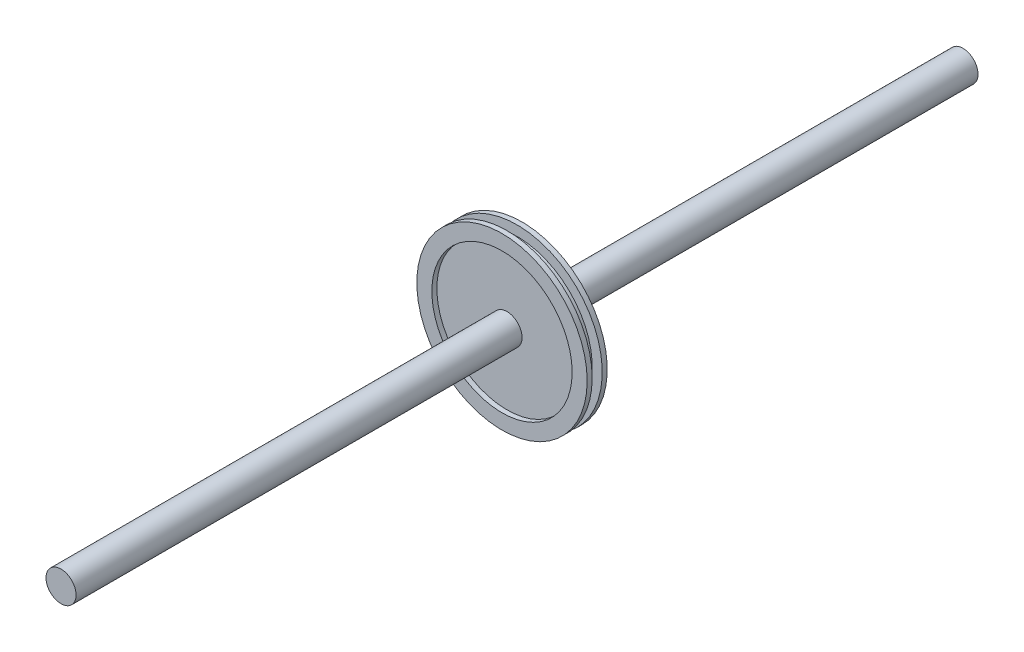
from build123d import *

# Parameters (mm, degrees)
SKETCH1_R           = 7.5
BOSS_EXTRUDE1_DEPTH = 0.5
SKETCH3_R           = 8.5
SKETCH3_R_2         = 7
BOSS_EXTRUDE2_DEPTH = 0.5
BOSS_EXTRUDE3_START = 0.5
SKETCH4_R           = 8.5
SKETCH4_R_2         = 7
BOSS_EXTRUDE3_DEPTH = 0.5
SKETCH6_R           = 1.5
BOSS_EXTRUDE4_DEPTH = 45


with BuildPart() as part:
    # Sketch1 → Boss-Extrude1 (new, symmetric)
    with BuildSketch(Plane.XY):
        Circle(SKETCH1_R)
    extrude(amount=BOSS_EXTRUDE1_DEPTH, both=True)

    # Sketch3 → Boss-Extrude2 (add)
    with BuildSketch(Plane.XY.offset(0.5)):
        Circle(SKETCH3_R)
        Circle(SKETCH3_R_2, mode=Mode.SUBTRACT)
    extrude(amount=BOSS_EXTRUDE2_DEPTH)

    # Sketch4 → Boss-Extrude3 (add)
    with BuildSketch(Plane(origin=(0, 0, -0.5), x_dir=(-1, 0, 0), z_dir=(0, 0, -1)).offset(BOSS_EXTRUDE3_START)):
        with Locations(Location((0, 0, 0), (0, 0, 180))):
            Circle(SKETCH4_R)
        with Locations(Location((0, 0, 0), (0, 0, 180))):
            Circle(SKETCH4_R_2, mode=Mode.SUBTRACT)
    extrude(amount=-BOSS_EXTRUDE3_DEPTH)

    # Sketch6 → Boss-Extrude4 (add, symmetric)
    with BuildSketch(Plane.XY):
        with Locations(Location((0, 0, 0), (0, 0, 180))):
            Circle(SKETCH6_R)
    extrude(amount=BOSS_EXTRUDE4_DEPTH, both=True)


solid = part.part
